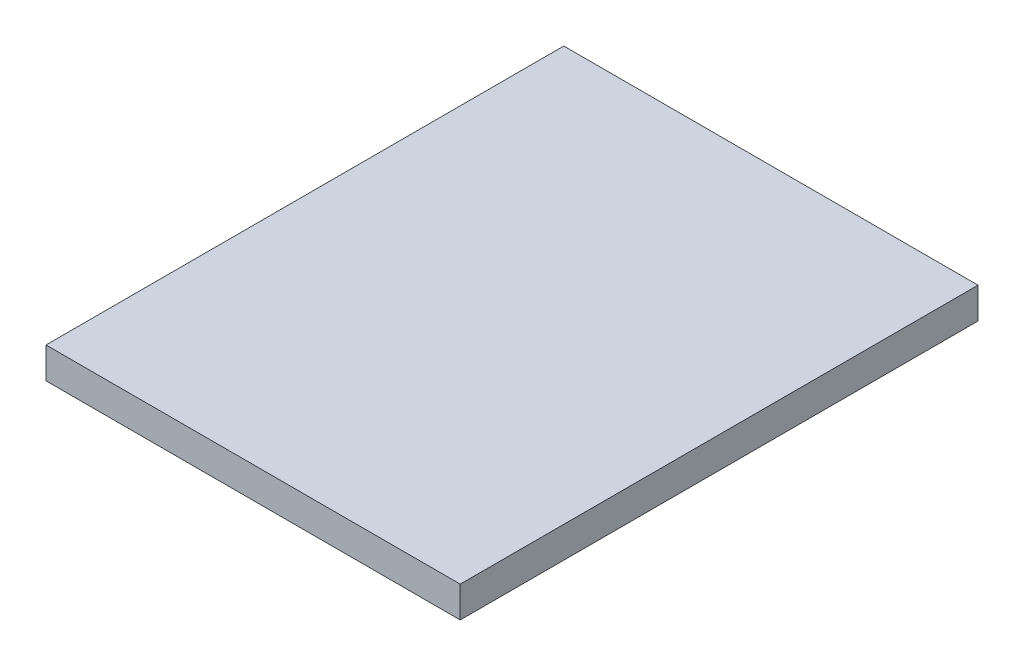
from build123d import *

# Parameters (mm, degrees)
SKETCH1_W           = 40
SKETCH1_H           = 50
BOSS_EXTRUDE1_DEPTH = 3


with BuildPart() as part:
    # Sketch1 → Boss-Extrude1 (new body)
    with BuildSketch(Plane(origin=(0, 0, 0), x_dir=(1, 0, 0), z_dir=(0, 1, 0))):
        with Locations((20, 25)):
            Rectangle(SKETCH1_W, SKETCH1_H)
    extrude(amount=BOSS_EXTRUDE1_DEPTH)


solid = part.part
